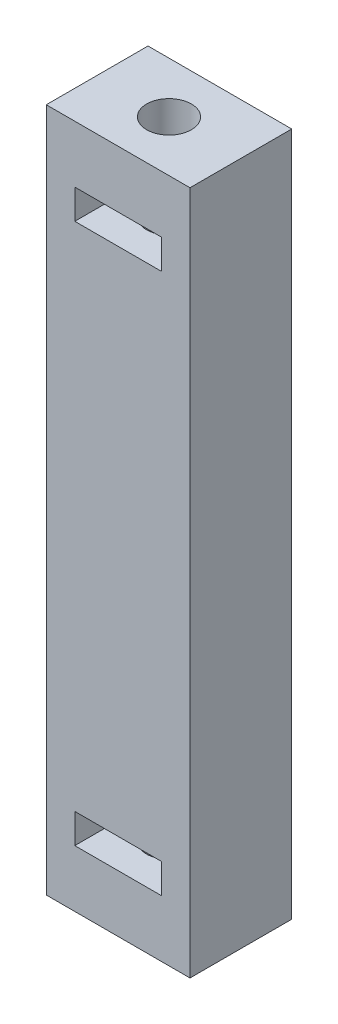
from build123d import *

# Parameters (mm, degrees)
SKETCH1_W                      = 16.002
SKETCH1_H                      = 11.3284
BOSS_EXTRUDE1_DEPTH            = 76.2
F_9_0_196_DIAMETER_HOLE1_D     = 4.9784
F_9_0_196_DIAMETER_HOLE1_DEPTH = 15.24
F_9_0_196_DIAMETER_HOLE1_TIP   = 1.495662253
F_9_0_196_DIAMETER_HOLE2_D     = 4.9784
F_9_0_196_DIAMETER_HOLE2_DEPTH = 15.24
F_9_0_196_DIAMETER_HOLE2_TIP   = 1.495662253
SKETCH9_W                      = 9.652
SKETCH9_H                      = 3.302
CUT_EXTRUDE1_DEPTH             = 76.2


with BuildPart() as part:
    # Sketch1 → Boss-Extrude1 (new body)
    with BuildSketch(Plane(origin=(0, 0, 0), x_dir=(1, 0, 0), z_dir=(0, 1, 0))):
        Rectangle(SKETCH1_W, SKETCH1_H)
    extrude(amount=BOSS_EXTRUDE1_DEPTH)

    # #9 (0.196) Diameter Hole1
    with Locations(Plane(origin=(0, 76.2, 0), x_dir=(1, 0, 0), z_dir=(0, 1, 0))):
        with Locations((0, 0)):
            Hole(F_9_0_196_DIAMETER_HOLE1_D / 2, depth=F_9_0_196_DIAMETER_HOLE1_DEPTH)
            with Locations((0, 0, -(F_9_0_196_DIAMETER_HOLE1_DEPTH + F_9_0_196_DIAMETER_HOLE1_TIP / 2))):  # 118° drill point
                Cone(0, F_9_0_196_DIAMETER_HOLE1_D / 2, F_9_0_196_DIAMETER_HOLE1_TIP, mode=Mode.SUBTRACT)

    # #9 (0.196) Diameter Hole2
    with Locations(Plane(origin=(0, 0, 0), x_dir=(-1, 0, 0), z_dir=(0, -1, 0))):
        with Locations((0, 0)):
            Hole(F_9_0_196_DIAMETER_HOLE2_D / 2, depth=F_9_0_196_DIAMETER_HOLE2_DEPTH)
            with Locations((0, 0, -(F_9_0_196_DIAMETER_HOLE2_DEPTH + F_9_0_196_DIAMETER_HOLE2_TIP / 2))):  # 118° drill point
                Cone(0, F_9_0_196_DIAMETER_HOLE2_D / 2, F_9_0_196_DIAMETER_HOLE2_TIP, mode=Mode.SUBTRACT)

    # Sketch9 → Cut-Extrude1 (cut)
    with BuildSketch(Plane(origin=(0, 0, -5.6642), x_dir=(-1, 0, 0), z_dir=(0, 0, -1))):
        with Locations((0, 8.001)):
            Rectangle(SKETCH9_W, SKETCH9_H)
        with Locations((0, 68.199)):
            Rectangle(SKETCH9_W, SKETCH9_H)
    extrude(amount=-CUT_EXTRUDE1_DEPTH, mode=Mode.SUBTRACT)


solid = part.part
